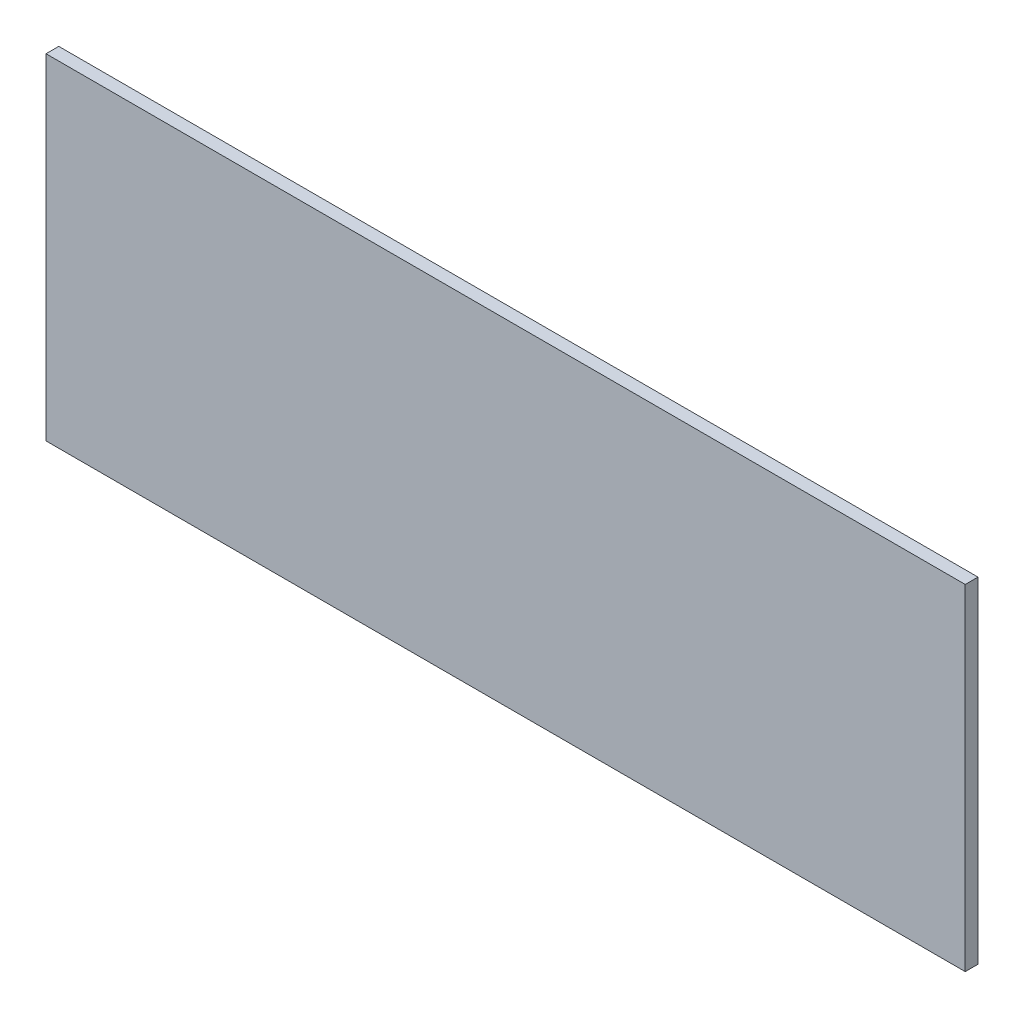
from build123d import *

# Parameters (mm, degrees)
SKETCH1_W           = 228.6
SKETCH1_H           = 83.3882
BOSS_EXTRUDE1_DEPTH = 3.175


with BuildPart() as part:
    # Sketch1 → Boss-Extrude1 (new body)
    with BuildSketch(Plane.XY):
        with Locations((114.3, 41.6941)):
            Rectangle(SKETCH1_W, SKETCH1_H)
    extrude(amount=BOSS_EXTRUDE1_DEPTH)


solid = part.part
